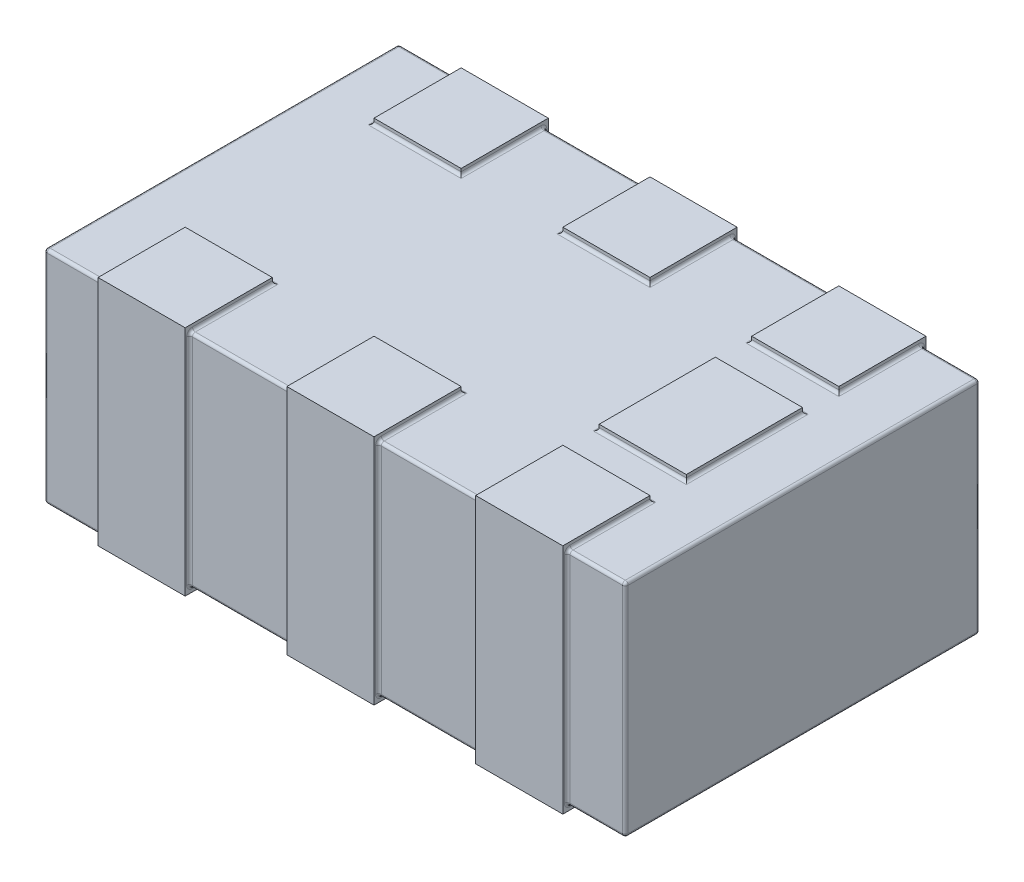
from build123d import *

# Parameters (mm, degrees)
SKETCH_2_W        = 0.3
SKETCH_2_H        = 0.3
EXTRUDE_1_DEPTH   = 0.02
EXTRUDE_1_2_DEPTH = 0.02
EXTRUDE_1_3_DEPTH = 0.02
EXTRUDE_1_4_DEPTH = 0.02
EXTRUDE_1_5_DEPTH = 0.02
EXTRUDE_1_6_DEPTH = 0.02
EXTRUDE_5_DEPTH   = 0.76
SKETCH_4_W        = 0.3
SKETCH_4_H        = 0.3
EXTRUDE_6_DEPTH   = 0.78
SKETCH_5_W        = 0.3
SKETCH_5_H        = 0.4
EXTRUDE_7_DEPTH   = 0.02
FILLET_1_R        = 0.01


with BuildPart() as part:
    # Эскиз2 → Бобышка-Вытянуть1 (new body)
    with BuildSketch(Plane(origin=(0, 0, 0), x_dir=(1, 0, 0), z_dir=(0, 1, 0))):
        with Locations((0, 0.475)):
            Rectangle(SKETCH_2_W, SKETCH_2_H)
    extrude(amount=EXTRUDE_1_DEPTH)



with BuildPart() as body_2:
    # Эскиз2 → Extrude 1 2 (new body)
    with BuildSketch(Plane(origin=(0, 0, 0), x_dir=(1, 0, 0), z_dir=(0, 1, 0))):
        with Locations((0.65, 0.475)):
            Rectangle(SKETCH_2_W, SKETCH_2_H)
    extrude(amount=EXTRUDE_1_2_DEPTH)


with BuildPart() as body_3:
    # Эскиз2 → Extrude 1 3 (new body)
    with BuildSketch(Plane(origin=(0, 0, 0), x_dir=(1, 0, 0), z_dir=(0, 1, 0))):
        with Locations((-0.65, 0.475)):
            Rectangle(SKETCH_2_W, SKETCH_2_H)
    extrude(amount=EXTRUDE_1_3_DEPTH)


with BuildPart() as body_4:
    # Эскиз2 → Extrude 1 4 (new body)
    with BuildSketch(Plane(origin=(0, 0, 0), x_dir=(1, 0, 0), z_dir=(0, 1, 0))):
        with Locations((0.65, -0.475)):
            Rectangle(SKETCH_2_W, SKETCH_2_H)
    extrude(amount=EXTRUDE_1_4_DEPTH)


with BuildPart() as body_5:
    # Эскиз2 → Extrude 1 5 (new body)
    with BuildSketch(Plane(origin=(0, 0, 0), x_dir=(1, 0, 0), z_dir=(0, 1, 0))):
        with Locations((0, -0.475)):
            Rectangle(SKETCH_2_W, SKETCH_2_H)
    extrude(amount=EXTRUDE_1_5_DEPTH)


with BuildPart() as body_6:
    # Эскиз2 → Extrude 1 6 (new body)
    with BuildSketch(Plane(origin=(0, 0, 0), x_dir=(1, 0, 0), z_dir=(0, 1, 0))):
        with Locations((-0.65, -0.475)):
            Rectangle(SKETCH_2_W, SKETCH_2_H)
    extrude(amount=EXTRUDE_1_6_DEPTH)


with BuildPart() as body_7:
    # Эскиз3 → Бобышка-Вытянуть5 (new body)
    with BuildSketch(Plane.XZ.offset(-0.02)):
        Polygon((1, -0.61), (1, 0.61), (0.8, 0.61), (0.8, 0.325), (0.5, 0.325), (0.5, 0.61), (0.15, 0.61), (0.15, 0.325), (-0.15, 0.325), (-0.15, 0.61), (-0.5, 0.61), (-0.5, 0.325), (-0.8, 0.325), (-0.8, 0.61), (-1, 0.61), (-1, -0.61), (-0.8, -0.61), (-0.8, -0.325), (-0.5, -0.325), (-0.5, -0.61), (-0.15, -0.61), (-0.15, -0.325), (0.15, -0.325), (0.15, -0.61), (0.5, -0.61), (0.5, -0.325), (0.8, -0.325), (0.8, -0.61), align=None)
    extrude(amount=-EXTRUDE_5_DEPTH)


with BuildPart() as part_1:
    add(part.part)

    add(body_2.part)  # Бобышка-Вытянуть6 merges body 2

    add(body_3.part)  # Бобышка-Вытянуть6 merges body 3

    add(body_4.part)  # Бобышка-Вытянуть6 merges body 4

    add(body_5.part)  # Бобышка-Вытянуть6 merges body 5

    add(body_6.part)  # Бобышка-Вытянуть6 merges body 6

    add(body_7.part)  # Бобышка-Вытянуть6 merges body 7
    # Эскиз4 → Бобышка-Вытянуть6 (add)
    with BuildSketch(Plane.XZ.offset(-0.02)):
        with Locations((0, 0.475)):
            Rectangle(SKETCH_4_W, SKETCH_4_H)
        with Locations((-0.65, 0.475)):
            Rectangle(SKETCH_4_W, SKETCH_4_H)
        with Locations((0.65, 0.475)):
            Rectangle(SKETCH_4_W, SKETCH_4_H)
        with Locations((-0.65, -0.475)):
            Rectangle(SKETCH_4_W, SKETCH_4_H)
        with Locations((0, -0.475)):
            Rectangle(SKETCH_4_W, SKETCH_4_H)
        with Locations((0.65, -0.475)):
            Rectangle(SKETCH_4_W, SKETCH_4_H)
    extrude(amount=-EXTRUDE_6_DEPTH)

    # Эскиз5 → Бобышка-Вытянуть7 (add)
    with BuildSketch(Plane(origin=(0, 0.78, 0), x_dir=(1, 0, 0), z_dir=(0, 1, 0))):
        with Locations((0.65, 0)):
            Rectangle(SKETCH_5_W, SKETCH_5_H)
    extrude(amount=EXTRUDE_7_DEPTH)

    # Скругление1
    fillet_1_edges = [part_1.edges().sort_by_distance(p)[0] for p in [
        (-0.5, 0.02, 0.4675),
        (-0.65, 0.02, 0.325),
        (-0.8, 0.02, 0.4675),
        (0.15, 0.02, 0.4675),
        (0, 0.02, 0.325),
        (-0.15, 0.02, 0.4675),
        (0.8, 0.02, 0.4675),
        (0.65, 0.02, 0.325),
        (0.5, 0.02, 0.4675),
        (-0.5, 0.02, -0.4675),
        (-0.8, 0.02, -0.4675),
        (-0.65, 0.02, -0.325),
        (0.15, 0.02, -0.4675),
        (-0.15, 0.02, -0.4675),
        (0, 0.02, -0.325),
        (0.8, 0.78, 0),
        (0.65, 0.78, -0.2),
        (0.5, 0.78, 0),
        (0.65, 0.78, 0.2),
        (0.325, 0.02, -0.61),
        (0.5, 0.4, -0.61),
        (0.15, 0.4, -0.61),
        (0, 0.78, -0.325),
        (-0.15, 0.78, -0.4675),
        (-0.325, 0.02, -0.61),
        (-0.15, 0.4, -0.61),
        (-0.5, 0.4, -0.61),
        (-0.65, 0.78, -0.325),
        (-0.8, 0.78, -0.4675),
        (-0.9, 0.02, -0.61),
        (-0.8, 0.4, -0.61),
        (-1, 0.78, 0),
        (-1, 0.4, -0.61),
        (-0.9, 0.78, 0.61),
        (-1, 0.4, 0.61),
        (-0.8, 0.78, 0.4675),
        (-0.8, 0.4, 0.61),
        (-0.325, 0.78, 0.61),
        (-0.5, 0.4, 0.61),
        (-0.15, 0.78, 0.4675),
        (-0.15, 0.4, 0.61),
        (0.325, 0.78, 0.61),
        (0.15, 0.4, 0.61),
        (0.5, 0.78, 0.4675),
        (0.5, 0.4, 0.61),
        (0.9, 0.78, 0.61),
        (0.8, 0.4, 0.61),
        (1, 0.02, 0),
        (1, 0.4, 0.61),
        (0.9, 0.02, -0.61),
        (1, 0.4, -0.61),
        (0.8, 0.02, -0.4675),
        (0.8, 0.4, -0.61),
        (0.65, 0.78, -0.325),
        (0.5, 0.78, -0.4675),
        (0.325, 0.78, -0.61),
        (0.15, 0.78, -0.4675),
        (-0.325, 0.78, -0.61),
        (-0.5, 0.78, -0.4675),
        (-0.9, 0.78, -0.61),
        (-0.65, 0.78, 0.325),
        (-0.5, 0.78, 0.4675),
        (0, 0.78, 0.325),
        (0.15, 0.78, 0.4675),
        (0.65, 0.78, 0.325),
        (0.8, 0.78, 0.4675),
        (1, 0.78, 0),
        (0.9, 0.78, -0.61),
        (0.8, 0.78, -0.4675),
        (0.5, 0.02, -0.4675),
        (0.65, 0.02, -0.325),
        (0.9, 0.02, 0.61),
        (0.325, 0.02, 0.61),
        (-0.325, 0.02, 0.61),
        (-0.9, 0.02, 0.61),
        (-1, 0.02, 0),
    ]]
    fillet(fillet_1_edges, radius=FILLET_1_R)


solid = part_1.part
